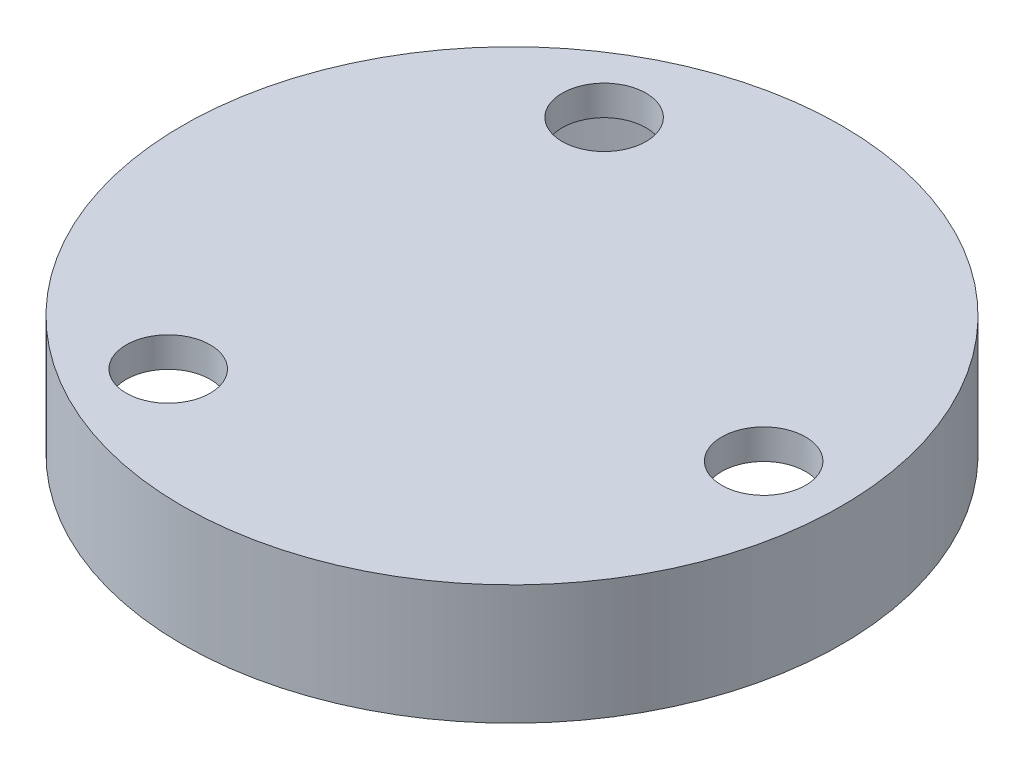
from build123d import *

# Parameters (mm, degrees)
SKETCH2_R             = 55
BOSS_EXTRUDE1_DEPTH   = 20
SKETCH3_R             = 50
CUT_EXTRUDE1_DEPTH    = 15
F_1_0MM_DOWEL_HOLE1_D = 14


with BuildPart() as part:
    # Sketch2 → Boss-Extrude1 (new body)
    with BuildSketch(Plane(origin=(0, 0, 0), x_dir=(1, 0, 0), z_dir=(0, 1, 0))):
        with Locations(Location((0, 0, 0), (0, 0, 270))):
            Circle(SKETCH2_R)
    extrude(amount=BOSS_EXTRUDE1_DEPTH)

    # Sketch3 → Cut-Extrude1 (cut)
    with BuildSketch(Plane.XZ):
        with Locations(Location((0, 0, 0), (0, 0, 270))):
            Circle(SKETCH3_R)
    extrude(amount=-CUT_EXTRUDE1_DEPTH, mode=Mode.SUBTRACT)

    # Ø1.0mm Dowel Hole1 (through all)
    with Locations(Plane(origin=(0, 20, 0), x_dir=(1, 0, 0), z_dir=(0, 1, 0))):
        with Locations((42, 0), (-21, 36.373066959), (-21, -36.373066959)):
            Hole(F_1_0MM_DOWEL_HOLE1_D / 2)


solid = part.part
